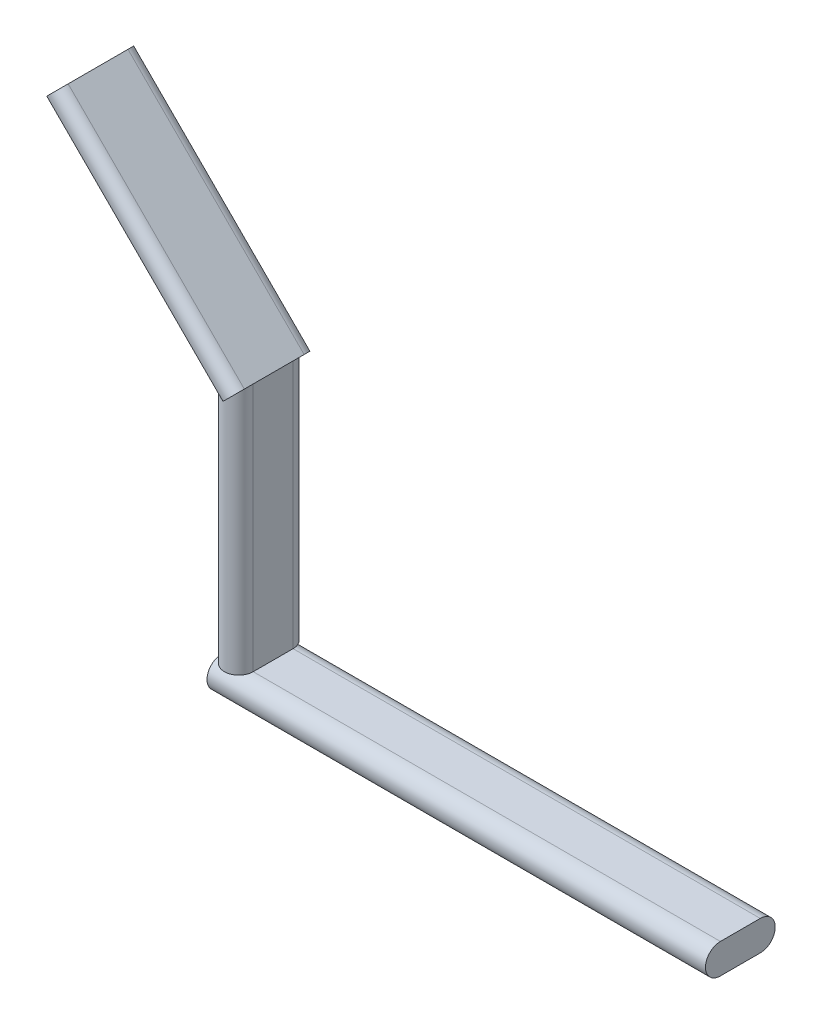
from build123d import *

# Parameters (mm, degrees)
BOSS_EXTRUDE1_DEPTH = 250
BOSS_EXTRUDE6_DEPTH = 125
BOSS_EXTRUDE7_DEPTH = 125


with BuildPart() as part:
    # Sketch1 → Boss-Extrude1 (new body)
    with BuildSketch(Plane(origin=(0, 0, 0), x_dir=(0, 0, -1), z_dir=(1, 0, 0))):
        with BuildLine():
            Line((-10, 7.5), (10, 7.5))
            ThreePointArc((10, 7.5), (17.5, 0), (10, -7.5))
            Line((10, -7.5), (-10, -7.5))
            ThreePointArc((-10, -7.5), (-17.5, 0), (-10, 7.5))
        make_face()
    extrude(amount=BOSS_EXTRUDE1_DEPTH)

    # Sketch11 → Boss-Extrude6 (add)
    with BuildSketch(Plane(origin=(0, 7.5, 0), x_dir=(1, 0, 0), z_dir=(0, 1, 0))):
        with BuildLine():
            Line((1.220843579, -10), (1.220843579, 10))
            ThreePointArc((1.220843579, 10), (8.447072594, 17.226229015), (15.673301609, 10))
            Line((15.673301609, 10), (15.673301609, -10))
            ThreePointArc((15.673301609, -10), (8.447072594, -17.226229015), (1.220843579, -10))
        make_face()
    extrude(amount=BOSS_EXTRUDE6_DEPTH)

    # Sketch12 → Boss-Extrude7 (add)
    with BuildSketch(Plane(origin=(-58.413349195, 58.413349195, 0), x_dir=(-0.7071067811865476, -0.7071067811865476, 0), z_dir=(0.7071067811865476, -0.7071067811865476, 0))):
        with BuildLine():
            Line((-105.56811993, -15), (-105.56811993, 15))
            ThreePointArc((-105.56811993, 15), (-100.022563681, 20.545556249), (-94.477007433, 15))
            Line((-94.477007433, 15), (-94.477007433, -15))
            ThreePointArc((-94.477007433, -15), (-100.022563681, -20.545556249), (-105.56811993, -15))
        make_face()
    extrude(amount=-BOSS_EXTRUDE7_DEPTH)


solid = part.part
